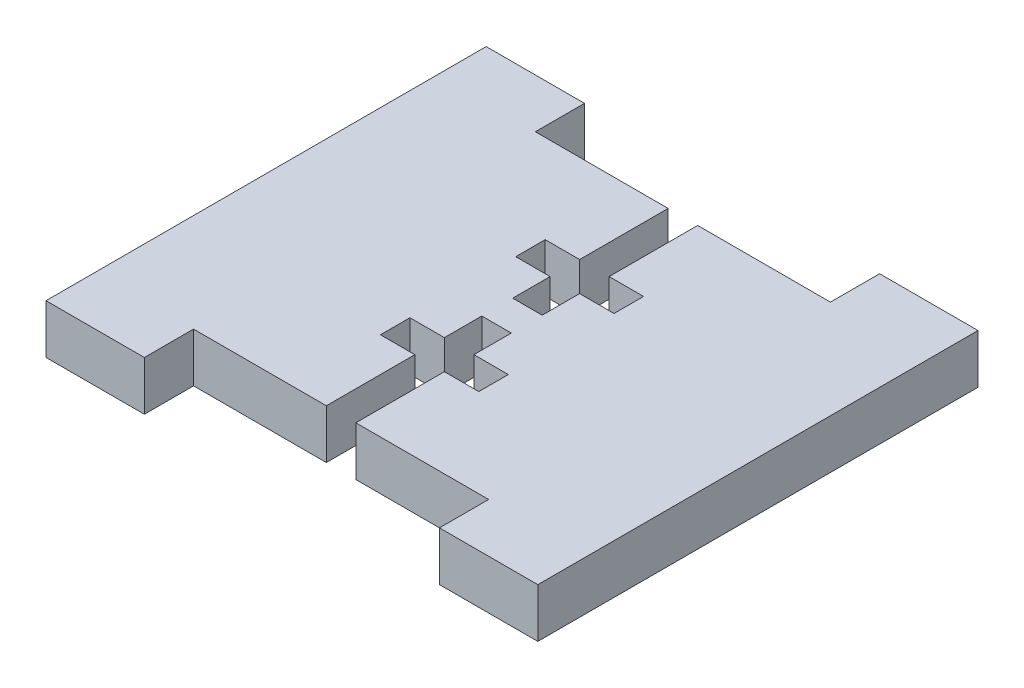
from build123d import *

# Parameters (mm, degrees)
SALIENTE_EXTRUIR1_DEPTH = 5


with BuildPart() as part:
    # Croquis1 → Saliente-Extruir1 (new body)
    with BuildSketch(Plane(origin=(0, 0, 0), x_dir=(1, 0, 0), z_dir=(0, 1, 0))):
        Polygon((0, 0), (10, 0), (10, 5), (23.5, 5), (23.5, 14), (20, 14), (20, 17), (23.5, 17), (23.5, 20.8038525), (26.5, 20.8038525), (26.5, 17), (30, 17), (30, 14), (26.5, 14), (26.5, 5), (40, 5), (40, 0), (50, 0), (50, 44.75), (40, 44.75), (40, 39.75), (26.5, 39.75), (26.5, 30.75), (30, 30.75), (30, 27.75), (26.5, 27.75), (26.5, 23.9461475), (23.5, 23.9461475), (23.5, 27.75), (20, 27.75), (20, 30.75), (23.5, 30.75), (23.5, 39.75), (10, 39.75), (10, 44.75), (0, 44.75), align=None)
    extrude(amount=SALIENTE_EXTRUIR1_DEPTH)


solid = part.part
